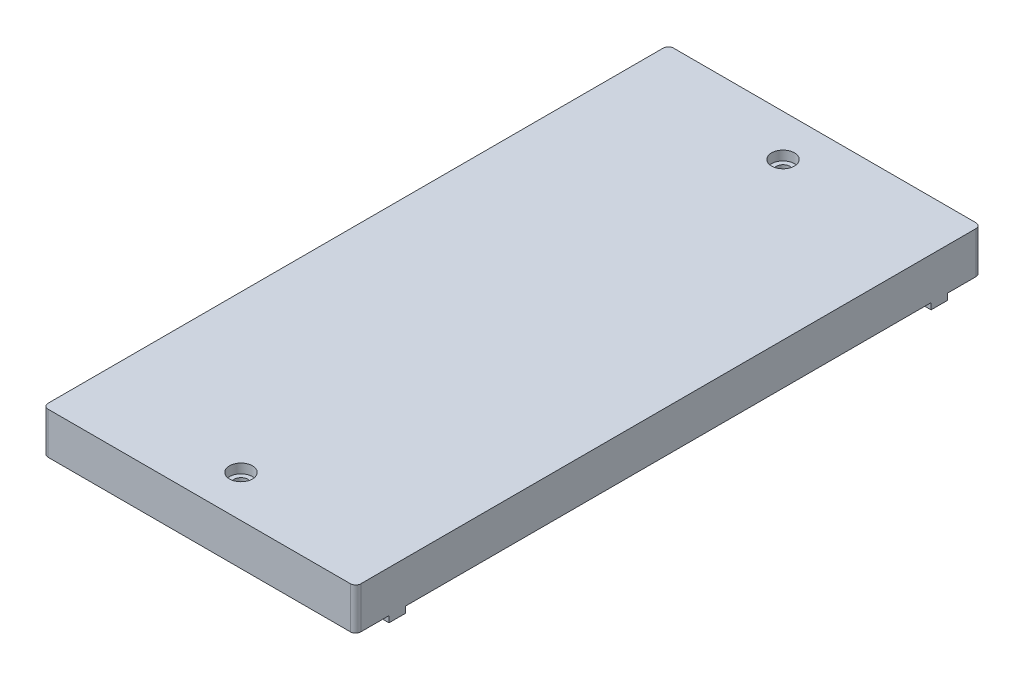
from build123d import *

# Parameters (mm, degrees)
SKETCH1_W                                            = 150
SKETCH1_H                                            = 300
BOSS_EXTRUDE1_DEPTH                                  = 20
SKETCH2_W                                            = 150
SKETCH2_H                                            = 8
BOSS_EXTRUDE2_DEPTH                                  = 3
CBORE_FOR_M6_HEX_SOCKET_THIN_HEAD_CAP_SC_D           = 6.6
CBORE_FOR_M6_HEX_SOCKET_THIN_HEAD_CAP_SC_DEPTH       = 24.5
CBORE_FOR_M6_HEX_SOCKET_THIN_HEAD_CAP_SC_CBORE_D     = 11
CBORE_FOR_M6_HEX_SOCKET_THIN_HEAD_CAP_SC_CBORE_DEPTH = 4.5
M8_TAPPED_HOLE1_D                                    = 6.8
M8_TAPPED_HOLE1_DEPTH                                = 33.75
FILLET1_R                                            = 2.5


with BuildPart() as part:
    # Sketch1 → Boss-Extrude1 (new body)
    with BuildSketch(Plane(origin=(0, 0, 0), x_dir=(1, 0, 0), z_dir=(0, 1, 0))):
        Rectangle(SKETCH1_W, SKETCH1_H)
    extrude(amount=BOSS_EXTRUDE1_DEPTH)

    # Sketch2 → Boss-Extrude2 (add)
    with BuildSketch(Plane(origin=(0, 0, 0), x_dir=(1, 0, 0), z_dir=(0, 1, 0))):
        with Locations((0, -130)):
            Rectangle(SKETCH2_W, SKETCH2_H)
        with Locations((0, 130)):
            Rectangle(SKETCH2_W, SKETCH2_H)
    extrude(amount=-BOSS_EXTRUDE2_DEPTH)

    # CBORE for M6 Hex Socket Thin Head Cap Screw1
    with Locations(Plane(origin=(0, 20, 0), x_dir=(1, 0, 0), z_dir=(0, 1, 0))):
        with Locations((0, -130), (0, 130)):
            CounterBoreHole(CBORE_FOR_M6_HEX_SOCKET_THIN_HEAD_CAP_SC_D / 2, CBORE_FOR_M6_HEX_SOCKET_THIN_HEAD_CAP_SC_CBORE_D / 2, CBORE_FOR_M6_HEX_SOCKET_THIN_HEAD_CAP_SC_CBORE_DEPTH, depth=CBORE_FOR_M6_HEX_SOCKET_THIN_HEAD_CAP_SC_DEPTH)

    # M8 Tapped Hole1
    with Locations(Plane.ZY.offset(75)):
        with Locations((0, 10)):
            Hole(M8_TAPPED_HOLE1_D / 2, depth=M8_TAPPED_HOLE1_DEPTH)

    # Fillet1
    fillet1_edges = [part.edges().sort_by_distance(p)[0] for p in [
        (-75, 10, -150),
        (75, 10, -150),
        (75, 10, 150),
        (-75, 10, 150),
    ]]
    fillet(fillet1_edges, radius=FILLET1_R)


solid = part.part
